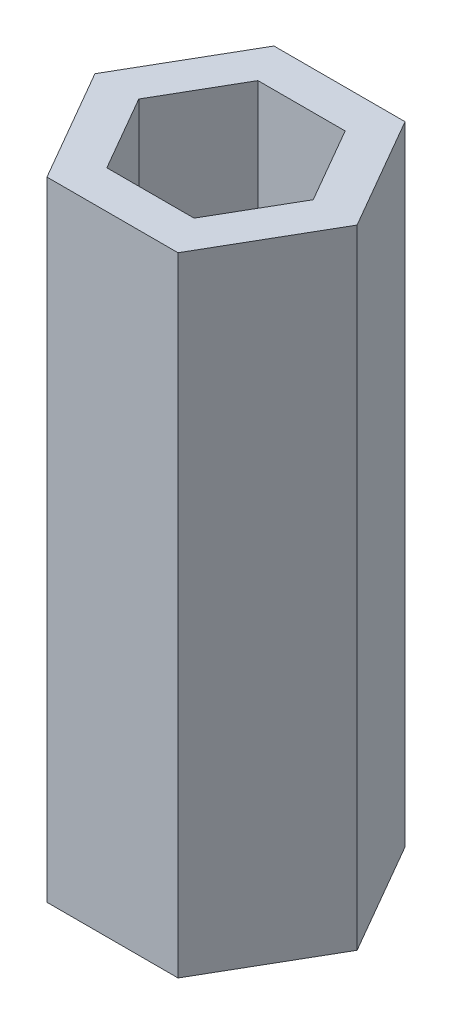
from build123d import *

# Parameters (mm, degrees)
BOSS_EXTRUDE1_DEPTH = 29.515472084


with BuildPart() as part:
    # Sketch1 → Boss-Extrude1 (new body)
    with BuildSketch(Plane(origin=(0, 0, 0), x_dir=(1, 0, 0), z_dir=(0, 1, 0))):
        Polygon((6.159172672, 0), (3.079586336, 5.334), (-3.079586336, 5.334), (-6.159172672, 0), (-3.079586336, -5.334), (3.079586336, -5.334), align=None)
        Polygon((4.098782766, 0), (2.049391383, 3.54965), (-2.049391383, 3.54965), (-4.098782766, 0), (-2.049391383, -3.54965), (2.049391383, -3.54965), align=None, mode=Mode.SUBTRACT)
    extrude(amount=BOSS_EXTRUDE1_DEPTH)


solid = part.part
